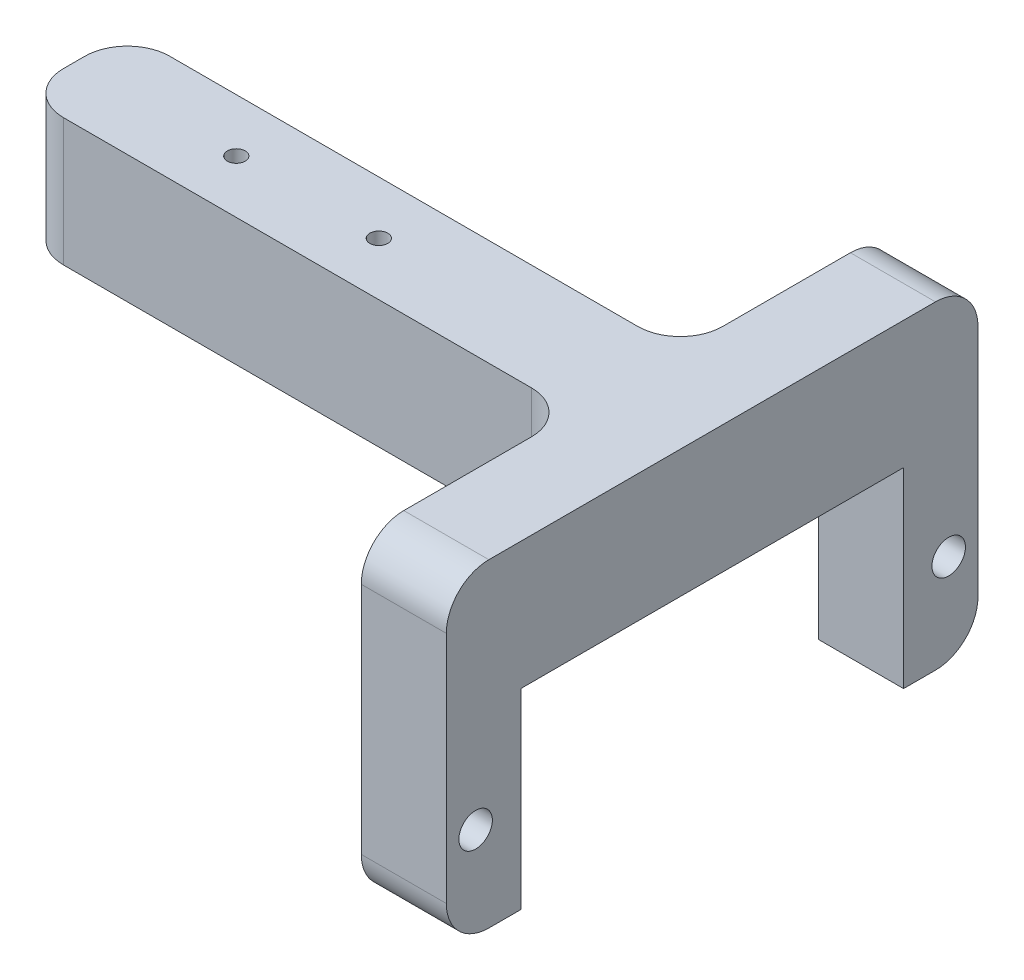
from build123d import *

# Parameters (mm, degrees)
SKETCH2_W           = 38.1
SKETCH2_H           = 6.35
BOSS_EXTRUDE1_DEPTH = 7.62
SKETCH3_W           = 5.08
SKETCH3_H           = 7.62
BOSS_EXTRUDE2_DEPTH = 12.7
SKETCH4_W           = 5.08
SKETCH4_H           = 4.445
BOSS_EXTRUDE3_DEPTH = 11.43
CUT_EXTRUDE2_DEPTH  = 43.828384571
FILLET1_R           = 2.54
SKETCH8_R           = 0.5334
CUT_EXTRUDE4_DEPTH  = 28.305


with BuildPart() as part:
    # Sketch2 → Boss-Extrude1 (new body)
    with BuildSketch(Plane(origin=(0, 0, 0), x_dir=(1, 0, 0), z_dir=(0, 1, 0))):
        Rectangle(SKETCH2_W, SKETCH2_H)
    extrude(amount=BOSS_EXTRUDE1_DEPTH)

    # Sketch3 → Boss-Extrude2 (add)
    with BuildSketch(Plane(origin=(0, 0, -3.175), x_dir=(-1, 0, 0), z_dir=(0, 0, -1))):
        with Locations((-16.51, 3.81)):
            Rectangle(SKETCH3_W, SKETCH3_H)
    boss_extrude2 = extrude(amount=BOSS_EXTRUDE2_DEPTH)

    # Mirror1: Boss-Extrude2 across plane
    add(boss_extrude2.mirror(Plane.XY))

    # Sketch4 → Boss-Extrude3 (add)
    with BuildSketch(Plane.XZ):
        with Locations((16.51, 13.6525)):
            Rectangle(SKETCH4_W, SKETCH4_H)
        with Locations((16.51, -13.6525)):
            Rectangle(SKETCH4_W, SKETCH4_H)
    extrude(amount=BOSS_EXTRUDE3_DEPTH)

    # Sketch6 → Cut-Extrude2 (cut, through all)
    with BuildSketch(Plane(origin=(19.05, 0, 0), x_dir=(0, 0, -1), z_dir=(1, 0, 0))):
        with BuildLine():
            ThreePointArc((-14.991025404, -5.45), (-15.125, -5.95), (-14.991025404, -6.45))
            ThreePointArc((-14.991025404, -6.45), (-13.866180955, -6.915925826), (-13.125, -5.95))
            ThreePointArc((-13.125, -5.95), (-13.866180955, -4.984074174), (-14.991025404, -5.45))
        make_face()
        with BuildLine():
            ThreePointArc((15.125, -5.95), (15.090925826, -5.691180955), (14.991025404, -5.45))
            ThreePointArc((14.991025404, -5.45), (13.125, -5.95), (14.991025404, -6.45))
            ThreePointArc((14.991025404, -6.45), (15.090925826, -6.208819045), (15.125, -5.95))
        make_face()
    extrude(amount=-CUT_EXTRUDE2_DEPTH, mode=Mode.SUBTRACT)

    # Fillet1
    fillet1_edges = [part.edges().sort_by_distance(p)[0] for p in [
        (13.97, 3.81, -3.175),
        (16.51, 7.62, -15.875),
        (16.51, 7.62, 15.875),
        (13.97, 3.81, 3.175),
        (16.51, -11.43, 15.875),
        (16.51, -11.43, -15.875),
        (-19.05, 3.81, 3.175),
        (-19.05, 3.81, -3.175),
    ]]
    fillet(fillet1_edges, radius=FILLET1_R)

    # Sketch8 → Cut-Extrude4 (cut, through all)
    with BuildSketch(Plane.XZ):
        with Locations(Location((-0.85725, 0, 0), (0, 0, 270))):
            Circle(SKETCH8_R)
        with Locations(Location((-9.36625, 0, 0), (0, 0, 270))):
            Circle(SKETCH8_R)
    extrude(amount=-CUT_EXTRUDE4_DEPTH, mode=Mode.SUBTRACT)


solid = part.part
